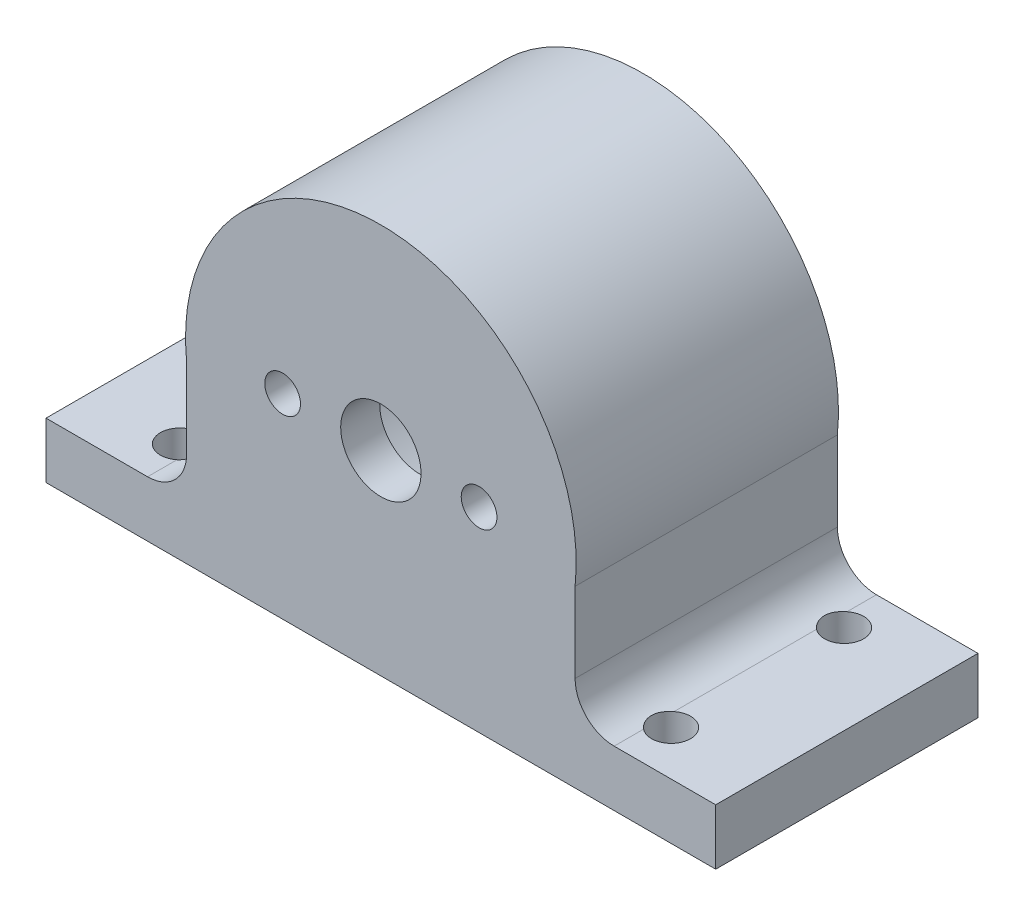
from build123d import *

# Parameters (mm, degrees)
SZKIC1_R                    = 17.5
SZKIC1_R_2                  = 12.6
DODANIE_WYCI_GNI_CIE1_DEPTH = 20
SZKIC2_R                    = 17.5
DODANIE_WYCI_GNI_CIE2_DEPTH = 3.5
DODANIE_WYCI_GNI_CIE3_START = -23.5
DODANIE_WYCI_GNI_CIE3_DEPTH = 23.5
SZKIC4_R                    = 3.6
SZKIC4_R_2                  = 1.6
WYTNIJ_WYCI_GNI_CIE1_DEPTH  = 41.078048855
SZKIC5_R                    = 1.75
WYTNIJ_WYCI_GNI_CIE2_DEPTH  = 52.742149163


with BuildPart() as part:
    # Szkic1 → Dodanie-wyciągnięcie1 (new body)
    with BuildSketch(Plane.XY):
        Circle(SZKIC1_R)
        Circle(SZKIC1_R_2, mode=Mode.SUBTRACT)
    extrude(amount=DODANIE_WYCI_GNI_CIE1_DEPTH)

    # Szkic2 → Dodanie-wyciągnięcie2 (add)
    with BuildSketch(Plane.XY.offset(20)):
        Circle(SZKIC2_R)
    extrude(amount=DODANIE_WYCI_GNI_CIE2_DEPTH)

    # Szkic3 → Dodanie-wyciągnięcie3 (add)
    with BuildSketch(Plane.XY.offset(23.5).offset(DODANIE_WYCI_GNI_CIE3_START)):
        with BuildLine():
            Line((-30, -12.5), (-30, -17.5))
            Line((-30, -17.5), (3e-09, -17.5))
            ThreePointArc((3e-09, -17.5), (-11.702275118, -13.011793), (-17.40200931, -1.849343661))
            Line((-17.40200931, -1.849343661), (-17.40200931, -9))
            ThreePointArc((-17.40200931, -9), (-18.427135576, -11.474873734), (-20.90200931, -12.5))
            Line((-20.90200931, -12.5), (-30, -12.5))
        make_face()
        with BuildLine():
            ThreePointArc((17.40200931, -1.849343661), (11.70227512, -13.011792998), (3e-09, -17.5))
            Line((3e-09, -17.5), (30, -17.5))
            Line((30, -17.5), (30, -12.5))
            Line((30, -12.5), (20.90200931, -12.5))
            ThreePointArc((20.90200931, -12.5), (18.427135576, -11.474873734), (17.40200931, -9))
            Line((17.40200931, -9), (17.40200931, -1.849343661))
        make_face()
    extrude(amount=DODANIE_WYCI_GNI_CIE3_DEPTH)

    # Szkic4 → Wytnij-wyciągnięcie1 (cut, through all)
    with BuildSketch(Plane(origin=(0, 0, 20), x_dir=(-1, 0, 0), z_dir=(0, 0, -1))):
        Circle(SZKIC4_R)
        with Locations((-8.8, 0)):
            Circle(SZKIC4_R_2)
        with Locations((8.8, 0)):
            Circle(SZKIC4_R_2)
    extrude(amount=-WYTNIJ_WYCI_GNI_CIE1_DEPTH, mode=Mode.SUBTRACT)

    # Szkic5 → Wytnij-wyciągnięcie2 (cut, through all)
    with BuildSketch(Plane.XZ.offset(17.5)):
        with Locations(Location((-22, 4, 0), (0, 0, 270))):
            Circle(SZKIC5_R)
        with Locations(Location((22, 4, 0), (0, 0, 231.139730474))):
            Circle(SZKIC5_R)
        with Locations(Location((22, 19.5, 0), (0, 0, 270))):
            Circle(SZKIC5_R)
        with Locations(Location((-22, 19.5, 0), (0, 0, 308.860269529))):
            Circle(SZKIC5_R)
    extrude(amount=-WYTNIJ_WYCI_GNI_CIE2_DEPTH, mode=Mode.SUBTRACT)


solid = part.part
